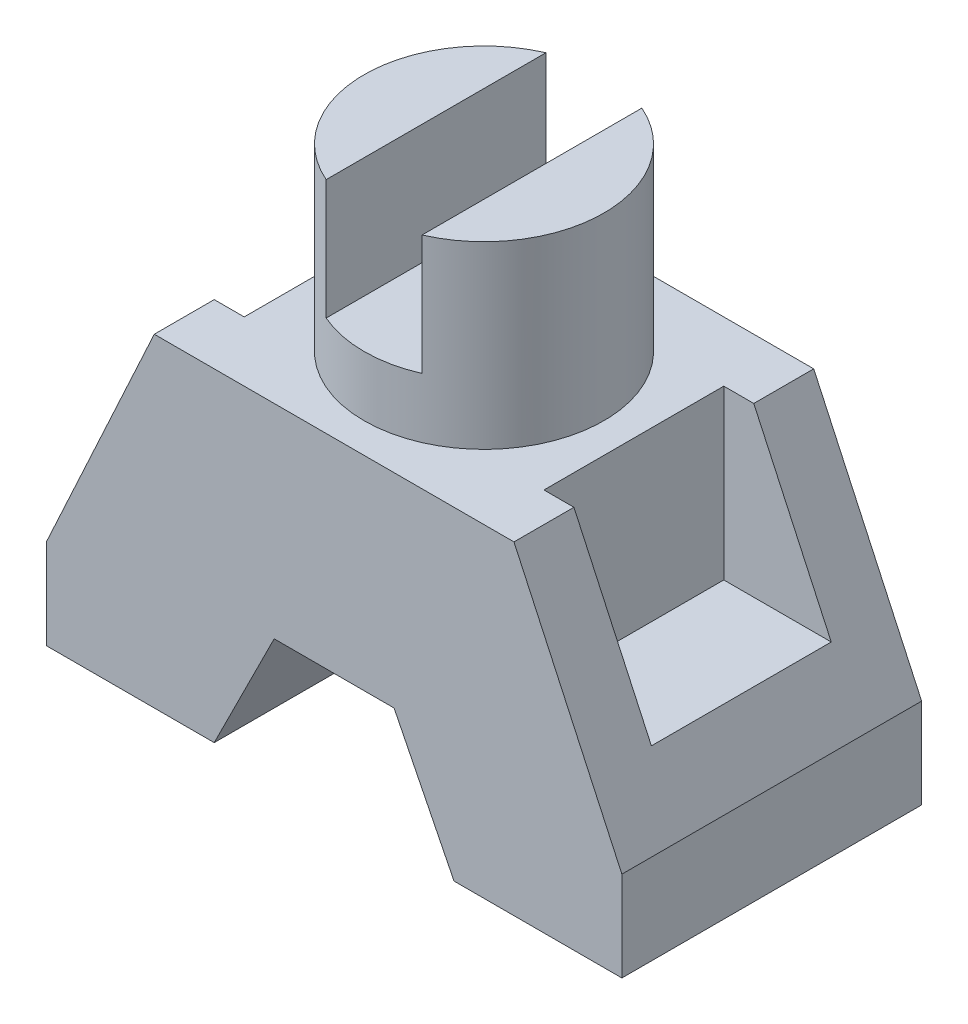
from build123d import *

# Parameters (mm, degrees)
BOSS_EXTRUDE1_DEPTH = 50
SKETCH2_R           = 20
BOSS_EXTRUDE2_DEPTH = 30
CUT_EXTRUDE1_START  = -20
CUT_EXTRUDE1_DEPTH  = 20
SKETCH4_W           = 30
SKETCH4_H           = 28
CUT_EXTRUDE2_DEPTH  = 23


with BuildPart() as part:
    # Sketch1 → Boss-Extrude1 (new body)
    with BuildSketch(Plane.XY):
        Polygon((14.59247247, 21.522973704), (-45.40752753, 21.522973704), (-63.40752753, -17.477026296), (-63.40752753, -32.477026296), (-35.40752753, -32.477026296), (-25.40752753, -12.477026296), (-5.40752753, -12.477026296), (4.59247247, -32.477026296), (32.59247247, -32.477026296), (32.59247247, -17.477026296), align=None)
    extrude(amount=BOSS_EXTRUDE1_DEPTH)

    # Sketch2 → Boss-Extrude2 (add)
    with BuildSketch(Plane(origin=(0, 21.522973704, 0), x_dir=(1, 0, 0), z_dir=(0, 1, 0))):
        with Locations(Location((-15.40752753, -25, 0), (0, 0, 270))):
            Circle(SKETCH2_R)
    extrude(amount=BOSS_EXTRUDE2_DEPTH)

    # Sketch3 → Cut-Extrude1 (cut)
    with BuildSketch(Plane(origin=(0, 51.522973704, 0), x_dir=(1, 0, 0), z_dir=(0, 1, 0)).offset(CUT_EXTRUDE1_START)):
        with BuildLine():
            Line((-7.40752753, -25), (-7.40752753, -6.66969722))
            ThreePointArc((-7.40752753, -6.66969722), (-15.40752753, -5), (-23.40752753, -6.66969722))
            Line((-23.40752753, -6.66969722), (-23.40752753, -43.33030278))
            ThreePointArc((-23.40752753, -43.33030278), (-15.40752753, -45), (-7.40752753, -43.33030278))
            Line((-7.40752753, -43.33030278), (-7.40752753, -25))
        make_face()
    extrude(amount=CUT_EXTRUDE1_DEPTH, mode=Mode.SUBTRACT)

    # Sketch4 → Cut-Extrude2 (cut)
    with BuildSketch(Plane.ZY.offset(63.40752753)):
        with Locations((25, 7.522973704)):
            Rectangle(SKETCH4_W, SKETCH4_H)
    cut_extrude2 = extrude(amount=-CUT_EXTRUDE2_DEPTH, mode=Mode.SUBTRACT)

    # Mirror1: Cut-Extrude2 across plane
    add(cut_extrude2.mirror(Plane(origin=(-15.40752753, 0, 0), x_dir=(0, 0, 1), z_dir=(1, 0, 0))), mode=Mode.SUBTRACT)


solid = part.part
